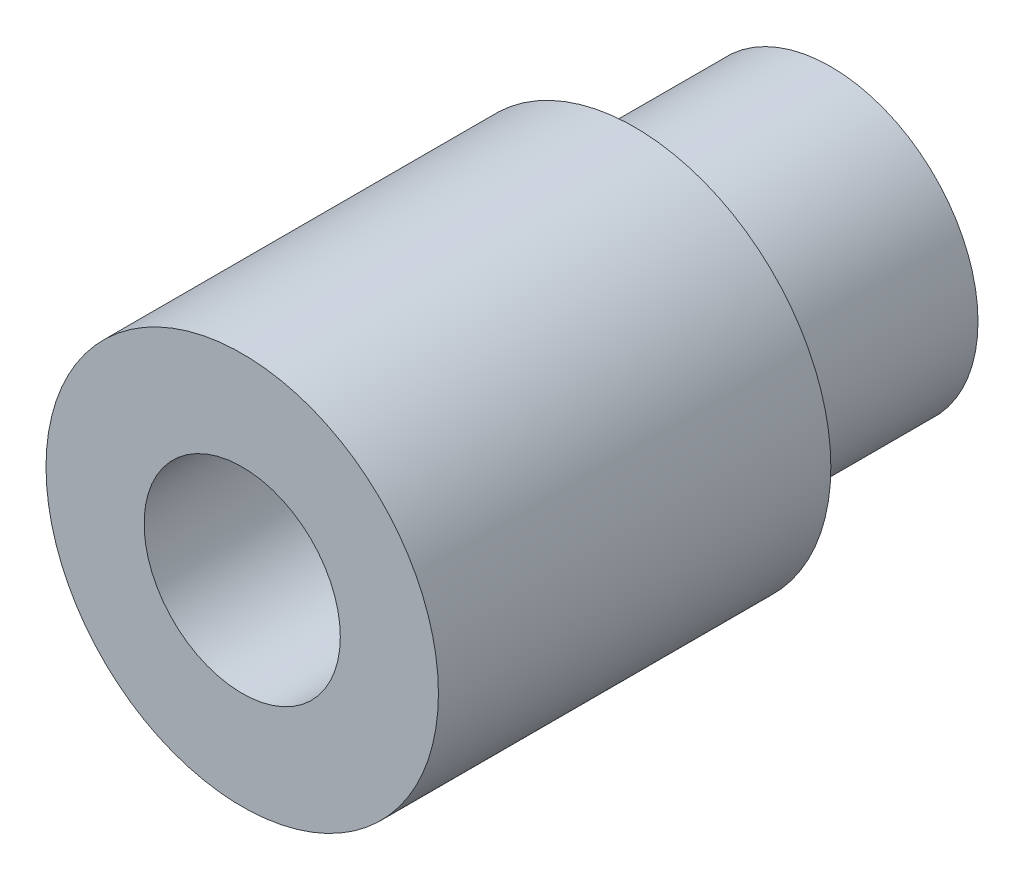
from build123d import *

# Parameters (mm, degrees)
SKETCH_1_R          = 3
EXTRUDE_1_DEPTH     = 6
SKETCH_2_R          = 2.25
EXTRUDE_2_DEPTH     = 3
SKETCH_3_R          = 1.5
CUT_EXTRUDE_1_DEPTH = 10


with BuildPart() as part:
    # Эскиз1 → Бобышка-Вытянуть1 (new body)
    with BuildSketch(Plane.XY):
        Circle(SKETCH_1_R)
    extrude(amount=EXTRUDE_1_DEPTH)

    # Эскиз2 → Бобышка-Вытянуть2 (add)
    with BuildSketch(Plane(origin=(0, 0, 0), x_dir=(-1, 0, 0), z_dir=(0, 0, -1))):
        with Locations(Location((0, 0.050430936, 0), (0, 0, 180))):
            Circle(SKETCH_2_R)
    extrude(amount=EXTRUDE_2_DEPTH)

    # Эскиз3 → Вырез-Вытянуть1 (cut)
    with BuildSketch(Plane.XY.offset(6)):
        Circle(SKETCH_3_R)
    extrude(amount=-CUT_EXTRUDE_1_DEPTH, mode=Mode.SUBTRACT)


solid = part.part
